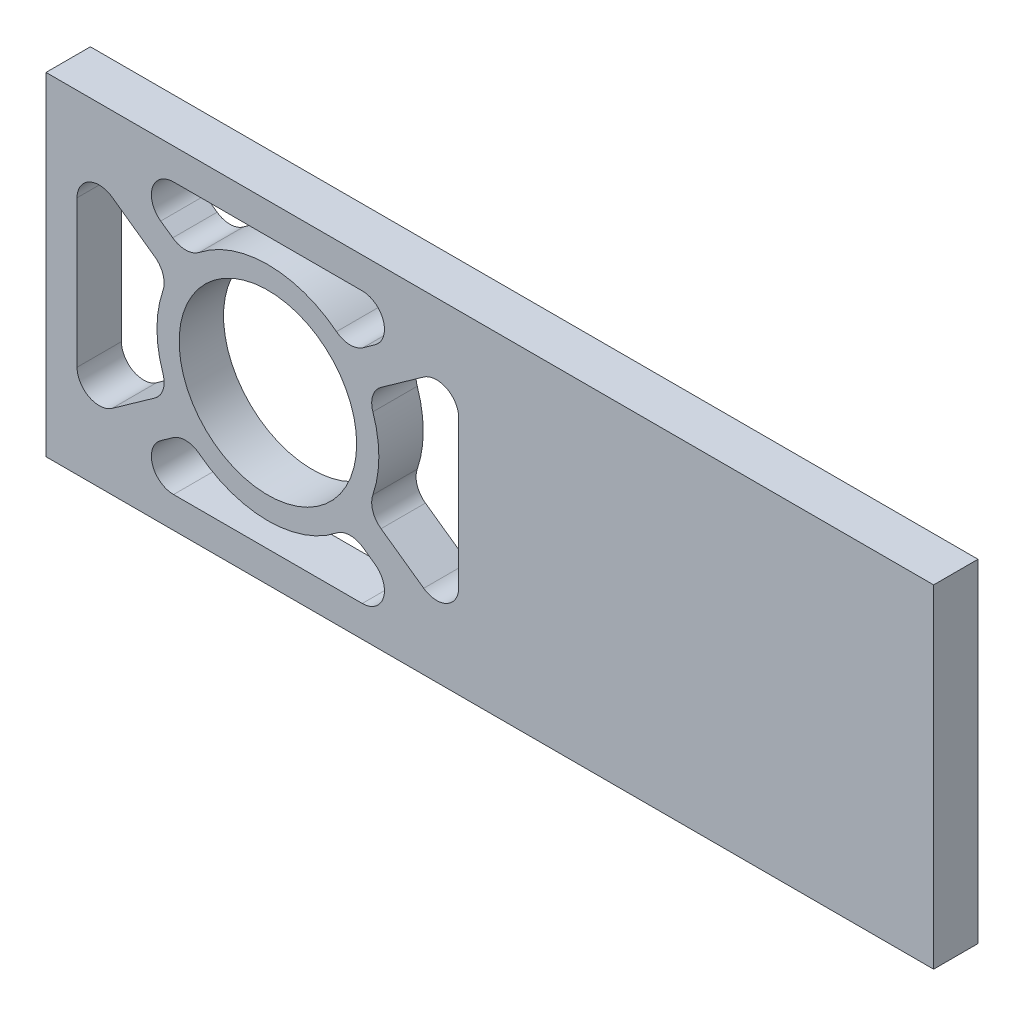
from build123d import *

# Parameters (mm, degrees)
SKETCH1_W           = 200
SKETCH1_H           = 75
BOSS_EXTRUDE3_DEPTH = 5
SKETCH2_R           = 20
CUT_EXTRUDE1_DEPTH  = 155.939504323
CUT_EXTRUDE2_DEPTH  = 155.939504323
FILLET1_R           = 5


with BuildPart() as part:
    # Sketch1 → Boss-Extrude3 (new, symmetric)
    with BuildSketch(Plane.XY):
        with Locations((50, 0)):
            Rectangle(SKETCH1_W, SKETCH1_H)
    extrude(amount=BOSS_EXTRUDE3_DEPTH, both=True)

    # Sketch2 → Cut-Extrude1 (cut, through all)
    with BuildSketch(Plane.XY.offset(5)):
        Circle(SKETCH2_R)
    extrude(amount=-CUT_EXTRUDE1_DEPTH, mode=Mode.SUBTRACT)

    # Sketch3 → Cut-Extrude2 (cut, through all)
    with BuildSketch(Plane.XY.offset(5)):
        with BuildLine():
            Line((-43, 26.20895177), (-43, -26.20895177))
            Line((-43, -26.20895177), (-22.215366719, -11.466363047))
            ThreePointArc((-22.215366719, -11.466363047), (-25, 0), (-22.215366719, 11.466363047))
            Line((-22.215366719, 11.466363047), (-43, 26.20895177))
        make_face()
        with BuildLine():
            Line((-36.950325446, 30.5), (36.950325446, 30.5))
            Line((36.950325446, 30.5), (18.165562093, 17.175923668))
            ThreePointArc((18.165562093, 17.175923668), (0, 25), (-18.165562093, 17.175923668))
            Line((-18.165562093, 17.175923668), (-36.950325446, 30.5))
        make_face()
        with BuildLine():
            Line((22.215366719, 11.466363047), (43, 26.20895177))
            Line((43, 26.20895177), (43, -26.20895177))
            Line((43, -26.20895177), (22.215366719, -11.466363047))
            ThreePointArc((22.215366719, -11.466363047), (25, 0), (22.215366719, 11.466363047))
        make_face()
        with BuildLine():
            Line((-18.165562093, -17.175923668), (-36.950325446, -30.5))
            Line((-36.950325446, -30.5), (36.950325446, -30.5))
            Line((36.950325446, -30.5), (18.165562093, -17.175923668))
            ThreePointArc((18.165562093, -17.175923668), (0, -25), (-18.165562093, -17.175923668))
        make_face()
    extrude(amount=-CUT_EXTRUDE2_DEPTH, mode=Mode.SUBTRACT)

    # Fillet1
    fillet1_edges = [part.edges().sort_by_distance(p)[0] for p in [
        (-43, 26.20895177, 0),
        (-22.215366719, 11.466363047, 0),
        (-22.215366719, -11.466363047, 0),
        (-43, -26.20895177, 0),
        (-18.165562093, 17.175923668, 0),
        (-36.950325446, 30.5, 0),
        (36.950325446, 30.5, 0),
        (18.165562093, 17.175923668, 0),
        (22.215366719, -11.466363047, 0),
        (22.215366719, 11.466363047, 0),
        (43, 26.20895177, 0),
        (43, -26.20895177, 0),
        (-18.165562093, -17.175923668, 0),
        (18.165562093, -17.175923668, 0),
        (36.950325446, -30.5, 0),
        (-36.950325446, -30.5, 0),
    ]]
    fillet(fillet1_edges, radius=FILLET1_R)


solid = part.part
